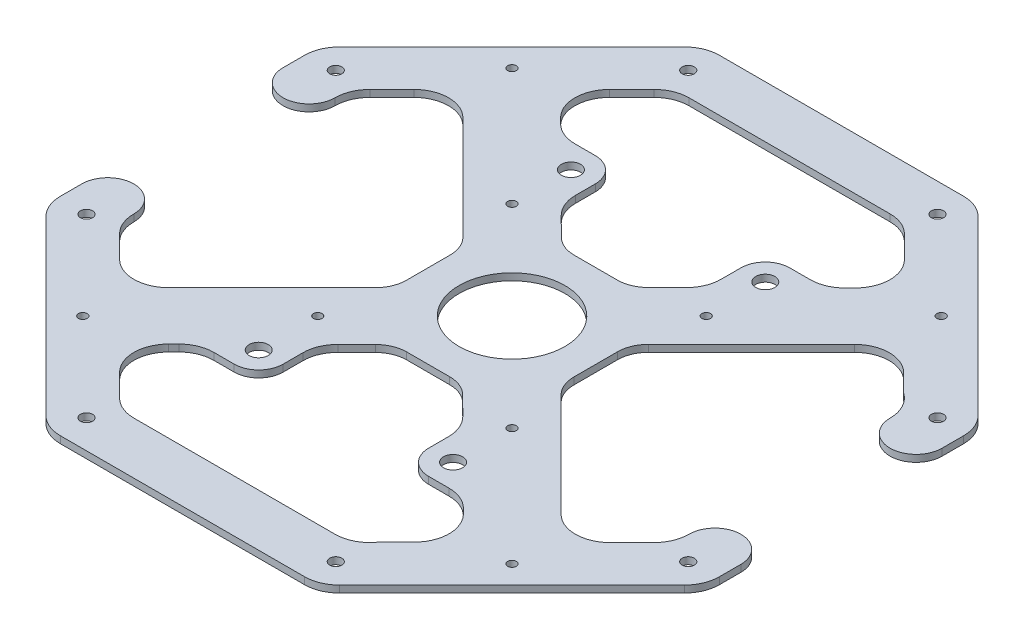
from build123d import *

# Parameters (mm, degrees)
SKETCH2_R           = 1.25
SKETCH2_R_2         = 1.75
SKETCH2_R_3         = 2.75
BOSS_EXTRUDE1_DEPTH = 2


with BuildPart() as part:
    # Sketch2 → Boss-Extrude1 (new body)
    with BuildSketch(Plane(origin=(0, 0, 0), x_dir=(1, 0, 0), z_dir=(0, 1, 0))):
        with BuildLine():
            Line((24.142135624, -6.273144482), (24.142135624, 0))
            Line((24.142135624, 0), (24.142135624, 6.273144482))
            ThreePointArc((24.142135624, 6.273144482), (24.827649201, 9.717819404), (26.779731412, 12.637594949))
            Line((26.779731412, 12.637594949), (56.468368159, 42.304675289))
            ThreePointArc((56.468368159, 42.304675289), (63.53883973, 45.231039727), (70.608156448, 42.301886572))
            Line((70.608156448, 42.301886572), (75.694551302, 37.21517354))
            ThreePointArc((75.694551302, 37.21517354), (78.858485001, 33.634695425), (80, 28.994949366))
            ThreePointArc((80, 28.994949366), (87.5, 21.494949366), (95, 28.994949366))
            Line((95, 28.994949366), (95, 35.208152802))
            ThreePointArc((95, 35.208152802), (94.238795325, 39.034987125), (92.071067812, 42.279220614))
            Line((92.071067812, 42.279220614), (42.279220614, 92.071067812))
            ThreePointArc((42.279220614, 92.071067812), (39.034987125, 94.238795325), (35.208152802, 95))
            Line((35.208152802, 95), (-35.208152802, 95))
            ThreePointArc((-35.208152802, 95), (-39.034987125, 94.238795325), (-42.279220614, 92.071067812))
            Line((-42.279220614, 92.071067812), (-92.071067812, 42.279220614))
            ThreePointArc((-92.071067812, 42.279220614), (-94.238795325, 39.034987125), (-95, 35.208152802))
            Line((-95, 35.208152802), (-95, 28.994949366))
            ThreePointArc((-95, 28.994949366), (-87.5, 21.494949366), (-80, 28.994949366))
            ThreePointArc((-80, 28.994949366), (-79.238795325, 32.82178369), (-77.071067812, 36.066017178))
            Line((-77.071067812, 36.066017178), (-70.710678119, 42.426406871))
            ThreePointArc((-70.710678119, 42.426406871), (-63.639610307, 45.355339059), (-56.568542495, 42.426406871))
            Line((-56.568542495, 42.426406871), (-26.777420433, 12.63528481))
            ThreePointArc((-26.777420433, 12.63528481), (-24.827023831, 9.716310016), (-24.142135624, 6.273144482))
            Line((-24.142135624, 6.273144482), (-24.142135624, -6.273144482))
            ThreePointArc((-24.142135624, -6.273144482), (-24.827023831, -9.716310016), (-26.777420433, -12.63528481))
            Line((-26.777420433, -12.63528481), (-56.568542495, -42.426406871))
            ThreePointArc((-56.568542495, -42.426406871), (-63.639766689, -45.355339058), (-70.710899273, -42.42618571))
            Line((-70.710899273, -42.42618571), (-77.018051571, -36.11863887))
            ThreePointArc((-77.018051571, -36.11863887), (-79.224438078, -32.856262892), (-80, -28.994949366))
            ThreePointArc((-80, -28.994949366), (-87.518972201, -21.532505276), (-95, -29.032987782))
            Line((-95, -29.032987782), (-95, -35.208152802))
            ThreePointArc((-95, -35.208152802), (-94.238795325, -39.034987125), (-92.071067812, -42.279220614))
            Line((-92.071067812, -42.279220614), (-42.279220614, -92.071067812))
            ThreePointArc((-42.279220614, -92.071067812), (-39.034987125, -94.238795325), (-35.208152802, -95))
            Line((-35.208152802, -95), (35.208152802, -95))
            ThreePointArc((35.208152802, -95), (39.034987125, -94.238795325), (42.279220614, -92.071067812))
            Line((42.279220614, -92.071067812), (92.071067812, -42.279220614))
            ThreePointArc((92.071067812, -42.279220614), (94.238795325, -39.034987125), (95, -35.208152802))
            Line((95, -35.208152802), (95, -28.994949366))
            ThreePointArc((95, -28.994949366), (87.5, -21.494949366), (80, -28.994949366))
            ThreePointArc((80, -28.994949366), (79.238795325, -32.82178369), (77.071067812, -36.066017178))
            Line((77.071067812, -36.066017178), (70.710678119, -42.426406871))
            ThreePointArc((70.710678119, -42.426406871), (63.639610307, -45.355339059), (56.568542495, -42.426406871))
            Line((56.568542495, -42.426406871), (26.777420433, -12.63528481))
            ThreePointArc((26.777420433, -12.63528481), (24.827023831, -9.716310016), (24.142135624, -6.273144482))
        make_face()
        with Locations(Location((-61.871843354, -61.871843354, 0), (0, 0, 270))):
            Circle(SKETCH2_R, mode=Mode.SUBTRACT)
        with Locations(Location((-35.928385408, -86.738795325, 0), (0, 0, 270))):
            Circle(SKETCH2_R_2, mode=Mode.SUBTRACT)
        with BuildLine():
            Line((-36.066017178, -77.071067812), (-42.49385989, -70.643225099))
            ThreePointArc((-42.49385989, -70.643225099), (-45.422791224, -63.568024355), (-42.488012626, -56.495247042))
            Line((-42.488012626, -56.495247042), (-40.972308908, -54.982133019))
            ThreePointArc((-40.972308908, -54.982133019), (-37.730173876, -52.818813648), (-33.90728957, -52.059244135))
            Line((-33.90728957, -52.059244135), (-28.020223739, -52.059244135))
            ThreePointArc((-28.020223739, -52.059244135), (-23.037212382, -49.995213249), (-20.973181496, -45.012201892))
            Line((-20.973181496, -45.012201892), (-20.973181496, -39.298846649))
            ThreePointArc((-20.973181496, -39.298846649), (-20.205038234, -35.45530386), (-18.018617262, -32.20223937))
            Line((-18.018617262, -32.20223937), (-12.595254252, -26.81798261))
            ThreePointArc((-12.595254252, -26.81798261), (-9.664285168, -24.842115466), (-6.198377489, -24.147770665))
            Line((-6.198377489, -24.147770665), (6.198377489, -24.147770665))
            ThreePointArc((6.198377489, -24.147770665), (9.664285168, -24.842115466), (12.595254252, -26.81798261))
            Line((12.595254252, -26.81798261), (18.018617262, -32.20223937))
            ThreePointArc((18.018617262, -32.20223937), (20.205038234, -35.45530386), (20.973181496, -39.298846649))
            Line((20.973181496, -39.298846649), (20.973181496, -45.012201892))
            ThreePointArc((20.973181496, -45.012201892), (23.037212382, -49.995213249), (28.020223739, -52.059244135))
            Line((28.020223739, -52.059244135), (33.90728957, -52.059244135))
            ThreePointArc((33.90728957, -52.059244135), (37.730173876, -52.818813648), (40.972308908, -54.982133019))
            Line((40.972308908, -54.982133019), (42.488012626, -56.495247042))
            ThreePointArc((42.488012626, -56.495247042), (45.309602969, -63.534055428), (42.380741747, -70.528908358))
            Line((42.380741747, -70.528908358), (37.216069936, -75.693257115))
            ThreePointArc((37.216069936, -75.693257115), (33.63539271, -78.858119754), (28.994949366, -80))
            Line((28.994949366, -80), (-28.994949366, -80))
            ThreePointArc((-28.994949366, -80), (-32.82178369, -79.238795325), (-36.066017178, -77.071067812))
        make_face(mode=Mode.SUBTRACT)
        with Locations(Location((-28.020223739, -45.012201892, 0), (0, 0, 270))):
            Circle(SKETCH2_R_3, mode=Mode.SUBTRACT)
        with Locations(Location((-86.738795325, -35.928385408, 0), (0, 0, 270))):
            Circle(SKETCH2_R_2, mode=Mode.SUBTRACT)
        with Locations(Location((-28, -28, 0), (0, 0, 270))):
            Circle(SKETCH2_R, mode=Mode.SUBTRACT)
        with BuildLine():
            ThreePointArc((0, 15.25), (10.783378413, 10.783378413), (15.25, 0))
            ThreePointArc((15.25, 0), (-10.783378413, -10.783378413), (0, 15.25))
        make_face(mode=Mode.SUBTRACT)
        with Locations(Location((35.928385408, -86.738795325, 0), (0, 0, 270))):
            Circle(SKETCH2_R_2, mode=Mode.SUBTRACT)
        with Locations(Location((28.020223739, -45.012201892, 0), (0, 0, 270))):
            Circle(SKETCH2_R_3, mode=Mode.SUBTRACT)
        with Locations(Location((61.871843354, -61.871843354, 0), (0, 0, 270))):
            Circle(SKETCH2_R, mode=Mode.SUBTRACT)
        with Locations(Location((28, -28, 0), (0, 0, 270))):
            Circle(SKETCH2_R, mode=Mode.SUBTRACT)
        with Locations(Location((86.738795325, -35.928385408, 0), (0, 0, 270))):
            Circle(SKETCH2_R_2, mode=Mode.SUBTRACT)
        with Locations(Location((-86.738795325, 35.928385408, 0), (0, 0, 270))):
            Circle(SKETCH2_R_2, mode=Mode.SUBTRACT)
        with Locations(Location((-28, 28, 0), (0, 0, 270))):
            Circle(SKETCH2_R, mode=Mode.SUBTRACT)
        with Locations(Location((-61.871843354, 61.871843354, 0), (0, 0, 270))):
            Circle(SKETCH2_R, mode=Mode.SUBTRACT)
        with Locations(Location((-28.020223739, 45.012201892, 0), (0, 0, 270))):
            Circle(SKETCH2_R_3, mode=Mode.SUBTRACT)
        with BuildLine():
            Line((6.206060109, 24.155528451), (0, 24.155528451))
            Line((0, 24.155528451), (-6.206060109, 24.155528451))
            ThreePointArc((-6.206060109, 24.155528451), (-9.666929362, 24.847771886), (-12.595254252, 26.81798261))
            Line((-12.595254252, 26.81798261), (-18.018617262, 32.20223937))
            ThreePointArc((-18.018617262, 32.20223937), (-20.205038234, 35.45530386), (-20.973181496, 39.298846649))
            Line((-20.973181496, 39.298846649), (-20.973181496, 45.012201892))
            ThreePointArc((-20.973181496, 45.012201892), (-23.037212382, 49.995213249), (-28.020223739, 52.059244135))
            Line((-28.020223739, 52.059244135), (-33.90728957, 52.059244135))
            ThreePointArc((-33.90728957, 52.059244135), (-37.730173876, 52.818813648), (-40.972308908, 54.982133019))
            Line((-40.972308908, 54.982133019), (-42.488012626, 56.495247042))
            ThreePointArc((-42.488012626, 56.495247042), (-45.422992439, 63.568239451), (-42.493839938, 70.643647124))
            Line((-42.493839938, 70.643647124), (-36.065796017, 77.071288966))
            ThreePointArc((-36.065796017, 77.071288966), (-32.821639211, 79.238855169), (-28.994949366, 80))
            Line((-28.994949366, 80), (28.994949366, 80))
            ThreePointArc((28.994949366, 80), (32.82178369, 79.238795325), (36.066017178, 77.071067812))
            Line((36.066017178, 77.071067812), (42.49385989, 70.643225099))
            ThreePointArc((42.49385989, 70.643225099), (45.422791224, 63.568024355), (42.488012626, 56.495247042))
            Line((42.488012626, 56.495247042), (40.972308908, 54.982133019))
            ThreePointArc((40.972308908, 54.982133019), (37.730173876, 52.818813648), (33.90728957, 52.059244135))
            Line((33.90728957, 52.059244135), (28.020223739, 52.059244135))
            ThreePointArc((28.020223739, 52.059244135), (23.037212382, 49.995213249), (20.973181496, 45.012201892))
            Line((20.973181496, 45.012201892), (20.973181496, 39.298846649))
            ThreePointArc((20.973181496, 39.298846649), (20.205038234, 35.45530386), (18.018617262, 32.20223937))
            Line((18.018617262, 32.20223937), (12.595254252, 26.81798261))
            ThreePointArc((12.595254252, 26.81798261), (9.666929362, 24.847771886), (6.206060109, 24.155528451))
        make_face(mode=Mode.SUBTRACT)
        with Locations(Location((-35.928385408, 86.738795325, 0), (0, 0, 270))):
            Circle(SKETCH2_R_2, mode=Mode.SUBTRACT)
        with Locations(Location((28, 28, 0), (0, 0, 270))):
            Circle(SKETCH2_R, mode=Mode.SUBTRACT)
        with Locations(Location((86.738795325, 35.928385408, 0), (0, 0, 270))):
            Circle(SKETCH2_R_2, mode=Mode.SUBTRACT)
        with Locations(Location((28.020223739, 45.012201892, 0), (0, 0, 270))):
            Circle(SKETCH2_R_3, mode=Mode.SUBTRACT)
        with Locations(Location((35.928385408, 86.738795325, 0), (0, 0, 270))):
            Circle(SKETCH2_R_2, mode=Mode.SUBTRACT)
        with Locations(Location((61.871843354, 61.871843354, 0), (0, 0, 270))):
            Circle(SKETCH2_R, mode=Mode.SUBTRACT)
    extrude(amount=BOSS_EXTRUDE1_DEPTH)


solid = part.part
